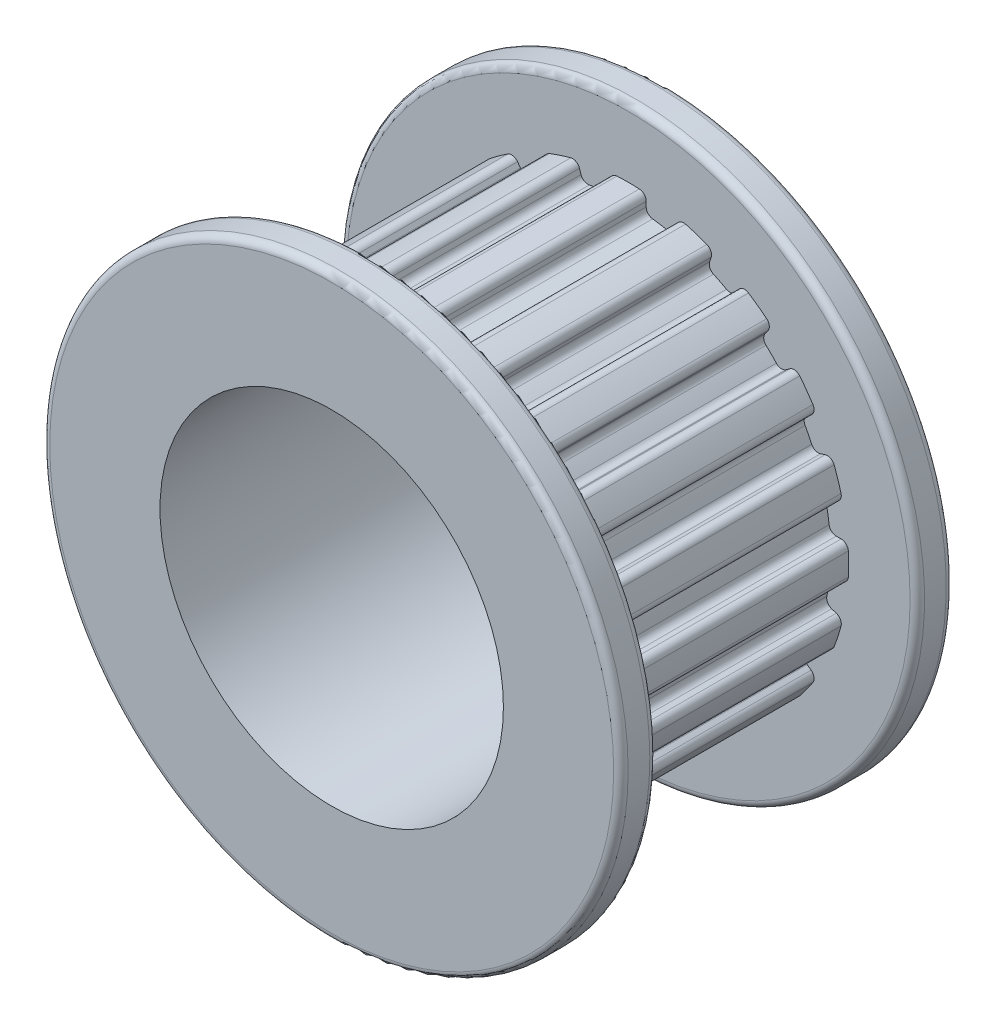
from build123d import *

# Parameters (mm, degrees)
P_IDAT_VYSUNUT_M1_DEPTH  = 7.2
ZAOBLIT1_R               = 0.2
ESBO_O1_R                = 8
RESSALTO_EXTRUS_O1_DEPTH = 1
RESSALTO_EXTRUS_O2_START = 1
ESBO_O2_R                = 8
RESSALTO_EXTRUS_O2_DEPTH = 1
FILETE3_R                = 0.2
FILETE4_R                = 0.2
ESBO_O3_R                = 4.75
CORTE_EXTRUS_O1_DEPTH    = 9.2


with BuildPart() as part:
    # Skica1 → Přidat vysunutím1 (new body)
    with BuildSketch(Plane.XY):
        with BuildLine():
            Line((-0.5, 6.079473661), (-0.5, 5.577633907))
            ThreePointArc((-0.5, 5.577633907), (-0.876033004, 5.531054707), (-1.248055408, 5.45915357))
            Line((-1.248055408, 5.45915357), (-1.40313242, 5.936431539))
            ThreePointArc((-1.40313242, 5.936431539), (-1.885003666, 5.801444749), (-2.354188936, 5.627414544))
            Line((-2.354188936, 5.627414544), (-2.199111924, 5.150136576))
            ThreePointArc((-2.199111924, 5.150136576), (-2.542346799, 4.989636535), (-2.873942456, 4.806293245))
            Line((-2.873942456, 4.806293245), (-3.168916463, 5.212290135))
            ThreePointArc((-3.168916463, 5.212290135), (-3.585490039, 4.935003666), (-3.977933457, 4.624504883))
            Line((-3.977933457, 4.624504883), (-3.68295945, 4.218507993))
            ThreePointArc((-3.68295945, 4.218507993), (-3.959797975, 3.959797975), (-4.218507993, 3.68295945))
            Line((-4.218507993, 3.68295945), (-4.624504883, 3.977933457))
            ThreePointArc((-4.624504883, 3.977933457), (-4.935003666, 3.585490039), (-5.212290135, 3.168916463))
            Line((-5.212290135, 3.168916463), (-4.806293245, 2.873942456))
            ThreePointArc((-4.806293245, 2.873942456), (-4.989636535, 2.542346799), (-5.150136576, 2.199111924))
            Line((-5.150136576, 2.199111924), (-5.627414544, 2.354188936))
            ThreePointArc((-5.627414544, 2.354188936), (-5.801444749, 1.885003666), (-5.936431539, 1.40313242))
            Line((-5.936431539, 1.40313242), (-5.45915357, 1.248055408))
            ThreePointArc((-5.45915357, 1.248055408), (-5.531054707, 0.876033004), (-5.577633907, 0.5))
            Line((-5.577633907, 0.5), (-6.079473661, 0.5))
            ThreePointArc((-6.079473661, 0.5), (-6.1, 0), (-6.079473661, -0.5))
            Line((-6.079473661, -0.5), (-5.577633907, -0.5))
            ThreePointArc((-5.577633907, -0.5), (-5.531054707, -0.876033004), (-5.45915357, -1.248055408))
            Line((-5.45915357, -1.248055408), (-5.936431539, -1.40313242))
            ThreePointArc((-5.936431539, -1.40313242), (-5.801444749, -1.885003666), (-5.627414544, -2.354188936))
            Line((-5.627414544, -2.354188936), (-5.150136576, -2.199111924))
            ThreePointArc((-5.150136576, -2.199111924), (-4.989636535, -2.542346799), (-4.806293245, -2.873942456))
            Line((-4.806293245, -2.873942456), (-5.212290135, -3.168916463))
            ThreePointArc((-5.212290135, -3.168916463), (-4.935003666, -3.585490039), (-4.624504883, -3.977933457))
            Line((-4.624504883, -3.977933457), (-4.218507993, -3.68295945))
            ThreePointArc((-4.218507993, -3.68295945), (-3.959797975, -3.959797975), (-3.68295945, -4.218507993))
            Line((-3.68295945, -4.218507993), (-3.977933457, -4.624504883))
            ThreePointArc((-3.977933457, -4.624504883), (-3.585490039, -4.935003666), (-3.168916463, -5.212290135))
            Line((-3.168916463, -5.212290135), (-2.873942456, -4.806293245))
            ThreePointArc((-2.873942456, -4.806293245), (-2.542346799, -4.989636535), (-2.199111924, -5.150136576))
            Line((-2.199111924, -5.150136576), (-2.354188936, -5.627414544))
            ThreePointArc((-2.354188936, -5.627414544), (-1.885003666, -5.801444749), (-1.40313242, -5.936431539))
            Line((-1.40313242, -5.936431539), (-1.248055408, -5.45915357))
            ThreePointArc((-1.248055408, -5.45915357), (-0.876033004, -5.531054707), (-0.5, -5.577633907))
            Line((-0.5, -5.577633907), (-0.5, -6.079473661))
            ThreePointArc((-0.5, -6.079473661), (0, -6.1), (0.5, -6.079473661))
            Line((0.5, -6.079473661), (0.5, -5.577633907))
            ThreePointArc((0.5, -5.577633907), (0.876033004, -5.531054707), (1.248055408, -5.45915357))
            Line((1.248055408, -5.45915357), (1.40313242, -5.936431539))
            ThreePointArc((1.40313242, -5.936431539), (1.885003666, -5.801444749), (2.354188936, -5.627414544))
            Line((2.354188936, -5.627414544), (2.199111924, -5.150136576))
            ThreePointArc((2.199111924, -5.150136576), (2.542346799, -4.989636535), (2.873942456, -4.806293245))
            Line((2.873942456, -4.806293245), (3.168916463, -5.212290135))
            ThreePointArc((3.168916463, -5.212290135), (3.585490039, -4.935003666), (3.977933457, -4.624504883))
            Line((3.977933457, -4.624504883), (3.68295945, -4.218507993))
            ThreePointArc((3.68295945, -4.218507993), (3.959797975, -3.959797975), (4.218507993, -3.68295945))
            Line((4.218507993, -3.68295945), (4.624504883, -3.977933457))
            ThreePointArc((4.624504883, -3.977933457), (4.935003666, -3.585490039), (5.212290135, -3.168916463))
            Line((5.212290135, -3.168916463), (4.806293245, -2.873942456))
            ThreePointArc((4.806293245, -2.873942456), (4.989636535, -2.542346799), (5.150136576, -2.199111924))
            Line((5.150136576, -2.199111924), (5.627414544, -2.354188936))
            ThreePointArc((5.627414544, -2.354188936), (5.801444749, -1.885003666), (5.936431539, -1.40313242))
            Line((5.936431539, -1.40313242), (5.45915357, -1.248055408))
            ThreePointArc((5.45915357, -1.248055408), (5.531054707, -0.876033004), (5.577633907, -0.5))
            Line((5.577633907, -0.5), (6.079473661, -0.5))
            ThreePointArc((6.079473661, -0.5), (6.1, 0), (6.079473661, 0.5))
            Line((6.079473661, 0.5), (5.577633907, 0.5))
            ThreePointArc((5.577633907, 0.5), (5.531054707, 0.876033004), (5.45915357, 1.248055408))
            Line((5.45915357, 1.248055408), (5.936431539, 1.40313242))
            ThreePointArc((5.936431539, 1.40313242), (5.801444749, 1.885003666), (5.627414544, 2.354188936))
            Line((5.627414544, 2.354188936), (5.150136576, 2.199111924))
            ThreePointArc((5.150136576, 2.199111924), (4.989636535, 2.542346799), (4.806293245, 2.873942456))
            Line((4.806293245, 2.873942456), (5.212290135, 3.168916463))
            ThreePointArc((5.212290135, 3.168916463), (4.935003666, 3.585490039), (4.624504883, 3.977933457))
            Line((4.624504883, 3.977933457), (4.218507993, 3.68295945))
            ThreePointArc((4.218507993, 3.68295945), (3.959797975, 3.959797975), (3.68295945, 4.218507993))
            Line((3.68295945, 4.218507993), (3.977933457, 4.624504883))
            ThreePointArc((3.977933457, 4.624504883), (3.585490039, 4.935003666), (3.168916463, 5.212290135))
            Line((3.168916463, 5.212290135), (2.873942456, 4.806293245))
            ThreePointArc((2.873942456, 4.806293245), (2.542346799, 4.989636535), (2.199111924, 5.150136576))
            Line((2.199111924, 5.150136576), (2.354188936, 5.627414544))
            ThreePointArc((2.354188936, 5.627414544), (1.885003666, 5.801444749), (1.40313242, 5.936431539))
            Line((1.40313242, 5.936431539), (1.248055408, 5.45915357))
            ThreePointArc((1.248055408, 5.45915357), (0.876033004, 5.531054707), (0.5, 5.577633907))
            Line((0.5, 5.577633907), (0.5, 6.079473661))
            ThreePointArc((0.5, 6.079473661), (0, 6.1), (-0.5, 6.079473661))
        make_face()
    extrude(amount=P_IDAT_VYSUNUT_M1_DEPTH)

    # Zaoblit1
    zaoblit1_edges = [part.edges().sort_by_distance(p)[0] for p in [
        (0.5, 6.079473661, 3.6),
        (0.5, 5.577633907, 3.6),
        (1.248055408, 5.45915357, 3.6),
        (1.40313242, 5.936431539, 3.6),
        (2.354188936, 5.627414544, 3.6),
        (2.199111924, 5.150136576, 3.6),
        (2.873942456, 4.806293245, 3.6),
        (3.168916463, 5.212290135, 3.6),
        (3.977933457, 4.624504883, 3.6),
        (3.68295945, 4.218507993, 3.6),
        (4.218507993, 3.68295945, 3.6),
        (4.624504883, 3.977933457, 3.6),
        (5.212290135, 3.168916463, 3.6),
        (4.806293245, 2.873942456, 3.6),
        (5.150136576, 2.199111924, 3.6),
        (5.627414544, 2.354188936, 3.6),
        (5.936431539, 1.40313242, 3.6),
        (5.45915357, 1.248055408, 3.6),
        (5.577633907, 0.5, 3.6),
        (6.079473661, 0.5, 3.6),
        (6.079473661, -0.5, 3.6),
        (5.577633907, -0.5, 3.6),
        (5.45915357, -1.248055408, 3.6),
        (5.936431539, -1.40313242, 3.6),
        (5.627414544, -2.354188936, 3.6),
        (5.150136576, -2.199111924, 3.6),
        (4.806293245, -2.873942456, 3.6),
        (5.212290135, -3.168916463, 3.6),
        (4.624504883, -3.977933457, 3.6),
        (4.218507993, -3.68295945, 3.6),
        (3.68295945, -4.218507993, 3.6),
        (3.977933457, -4.624504883, 3.6),
        (3.168916463, -5.212290135, 3.6),
        (2.873942456, -4.806293245, 3.6),
        (2.199111924, -5.150136576, 3.6),
        (2.354188936, -5.627414544, 3.6),
        (1.40313242, -5.936431539, 3.6),
        (1.248055408, -5.45915357, 3.6),
        (0.5, -5.577633907, 3.6),
        (0.5, -6.079473661, 3.6),
        (-0.5, -6.079473661, 3.6),
        (-0.5, -5.577633907, 3.6),
        (-1.248055408, -5.45915357, 3.6),
        (-1.40313242, -5.936431539, 3.6),
        (-2.354188936, -5.627414544, 3.6),
        (-2.199111924, -5.150136576, 3.6),
        (-2.873942456, -4.806293245, 3.6),
        (-3.168916463, -5.212290135, 3.6),
        (-3.977933457, -4.624504883, 3.6),
        (-3.68295945, -4.218507993, 3.6),
        (-4.218507993, -3.68295945, 3.6),
        (-4.624504883, -3.977933457, 3.6),
        (-5.212290135, -3.168916463, 3.6),
        (-4.806293245, -2.873942456, 3.6),
        (-5.150136576, -2.199111924, 3.6),
        (-5.627414544, -2.354188936, 3.6),
        (-5.936431539, -1.40313242, 3.6),
        (-5.45915357, -1.248055408, 3.6),
        (-5.577633907, -0.5, 3.6),
        (-6.079473661, -0.5, 3.6),
        (-6.079473661, 0.5, 3.6),
        (-5.577633907, 0.5, 3.6),
        (-5.45915357, 1.248055408, 3.6),
        (-5.936431539, 1.40313242, 3.6),
        (-5.627414544, 2.354188936, 3.6),
        (-5.150136576, 2.199111924, 3.6),
        (-4.806293245, 2.873942456, 3.6),
        (-5.212290135, 3.168916463, 3.6),
        (-4.624504883, 3.977933457, 3.6),
        (-4.218507993, 3.68295945, 3.6),
        (-3.68295945, 4.218507993, 3.6),
        (-3.977933457, 4.624504883, 3.6),
        (-3.168916463, 5.212290135, 3.6),
        (-2.873942456, 4.806293245, 3.6),
        (-2.199111924, 5.150136576, 3.6),
        (-2.354188936, 5.627414544, 3.6),
        (-1.40313242, 5.936431539, 3.6),
        (-1.248055408, 5.45915357, 3.6),
        (-0.5, 5.577633907, 3.6),
        (-0.5, 6.079473661, 3.6),
    ]]
    fillet(zaoblit1_edges, radius=ZAOBLIT1_R)

    # Esboço1 → Ressalto-extrusão1 (add)
    with BuildSketch(Plane.XY.offset(7.2)):
        Circle(ESBO_O1_R)
    extrude(amount=RESSALTO_EXTRUS_O1_DEPTH)

    # Esboço2 → Ressalto-extrusão2 (add)
    with BuildSketch(Plane(origin=(0, 0, 0), x_dir=(-1, 0, 0), z_dir=(0, 0, -1)).offset(RESSALTO_EXTRUS_O2_START)):
        with Locations(Location((0, 0, 0), (0, 0, 180))):
            Circle(ESBO_O2_R)
    extrude(amount=-RESSALTO_EXTRUS_O2_DEPTH)

    # Filete3
    filete3_edges = [part.edges().sort_by_distance(p)[0] for p in [
        (-8, 0, 7.2),
        (-8, 0, 8.2),
    ]]
    fillet(filete3_edges, radius=FILETE3_R)

    # Filete4
    filete4_edges = [part.edges().sort_by_distance(p)[0] for p in [
        (-8, 0, 0),
        (-8, 0, -1),
    ]]
    fillet(filete4_edges, radius=FILETE4_R)

    # Esboço3 → Corte-extrusão1 (cut)
    with BuildSketch(Plane.XY.offset(8.2)):
        Circle(ESBO_O3_R)
    extrude(amount=-CORTE_EXTRUS_O1_DEPTH, mode=Mode.SUBTRACT)


solid = part.part
